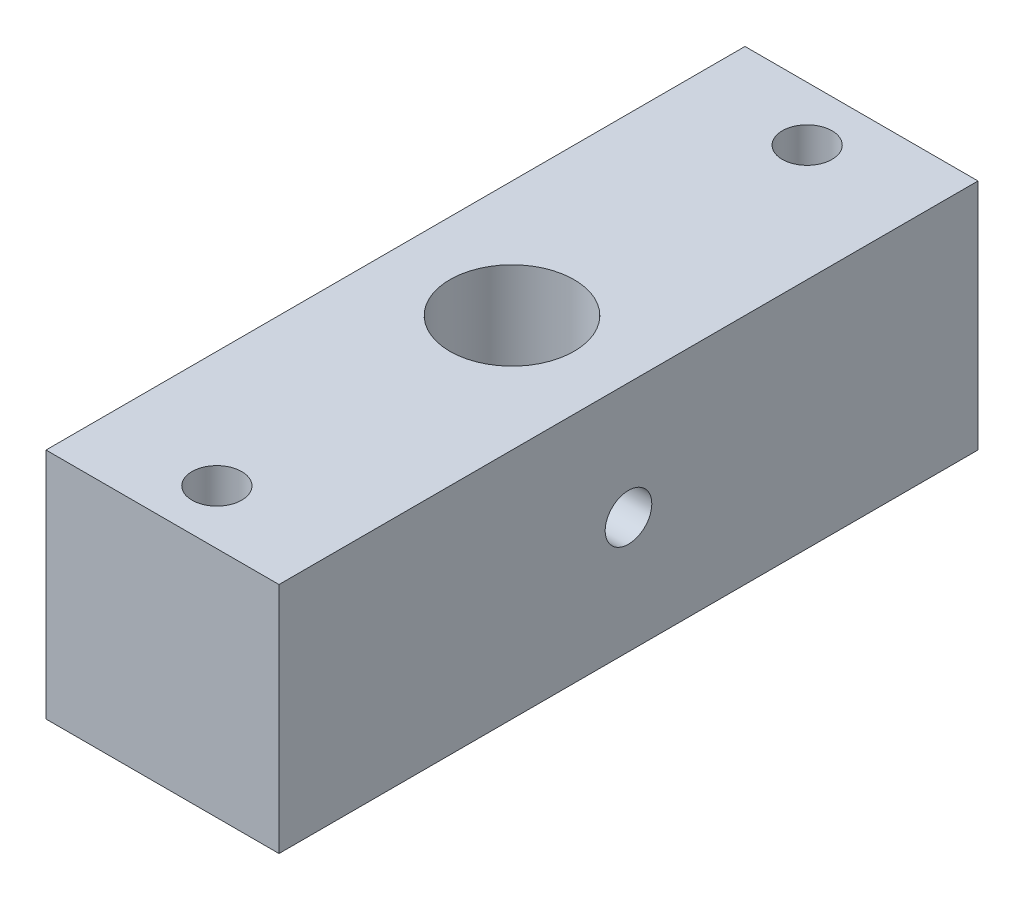
from build123d import *

# Parameters (mm, degrees)
SKETCH_1_W          = 15
SKETCH_1_H          = 45
SKETCH_1_R          = 4
SKETCH_1_R_2        = 1.6
EXTRUDE_1_DEPTH     = 7.5
SKETCH_2_R          = 1.5
CUT_EXTRUDE_1_DEPTH = 29.062430401


with BuildPart() as part:
    # 草图1 → 凸台-拉伸1 (new, symmetric)
    with BuildSketch(Plane(origin=(0, 0, 0), x_dir=(1, 0, 0), z_dir=(0, 1, 0))):
        Rectangle(SKETCH_1_W, SKETCH_1_H)
        with Locations(Location((0, 0, 0), (0, 0, 270))):
            Circle(SKETCH_1_R, mode=Mode.SUBTRACT)
        with Locations(Location((0, 19, 0), (0, 0, 270))):
            Circle(SKETCH_1_R_2, mode=Mode.SUBTRACT)
        with Locations(Location((0, -19, 0), (0, 0, 90))):
            Circle(SKETCH_1_R_2, mode=Mode.SUBTRACT)
    extrude(amount=EXTRUDE_1_DEPTH, both=True)

    # 草图2 → 切除-拉伸1 (cut, through all)
    with BuildSketch(Plane(origin=(7.5, 0, 0), x_dir=(0, 0, -1), z_dir=(1, 0, 0))):
        Circle(SKETCH_2_R)
    extrude(amount=-CUT_EXTRUDE_1_DEPTH, mode=Mode.SUBTRACT)


solid = part.part
